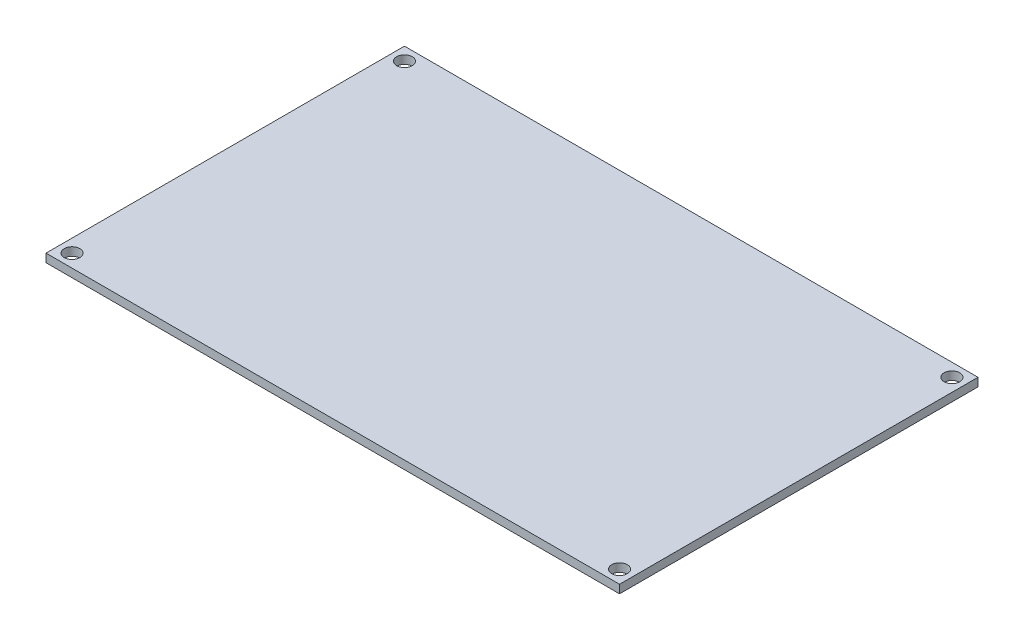
from build123d import *

# Parameters (mm, degrees)
SKETCH1_W           = 110
SKETCH1_H           = 68.75
SKETCH1_R           = 1.5
BOSS_EXTRUDE1_DEPTH = 1.6


with BuildPart() as part:
    # Sketch1 → Boss-Extrude1 (new body)
    with BuildSketch(Plane(origin=(0, 0, 0), x_dir=(1, 0, 0), z_dir=(0, 1, 0))):
        Rectangle(SKETCH1_W, SKETCH1_H)
        with Locations(Location((-52.5, 31.875, 0), (0, 0, 270))):
            Circle(SKETCH1_R, mode=Mode.SUBTRACT)
        with Locations(Location((-52.5, -31.875, 0), (0, 0, 90))):
            Circle(SKETCH1_R, mode=Mode.SUBTRACT)
        with Locations(Location((52.5, -31.875, 0), (0, 0, 270))):
            Circle(SKETCH1_R, mode=Mode.SUBTRACT)
        with Locations(Location((52.5, 31.875, 0), (0, 0, 90))):
            Circle(SKETCH1_R, mode=Mode.SUBTRACT)
    extrude(amount=BOSS_EXTRUDE1_DEPTH)


solid = part.part
